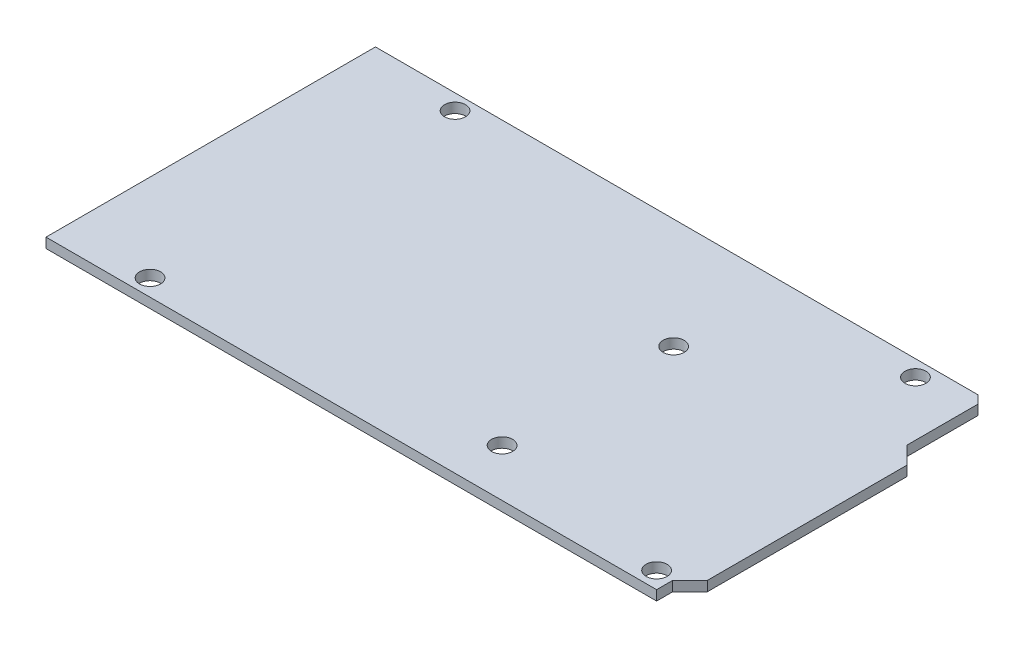
from build123d import *

# Parameters (mm, degrees)
SKETCH1_R           = 1.7
BOSS_EXTRUDE1_DEPTH = 1.6


with BuildPart() as part:
    # Sketch1 → Boss-Extrude1 (new body)
    with BuildSketch(Plane(origin=(0, 0, 0), x_dir=(1, 0, 0), z_dir=(0, 1, 0))):
        Polygon((98.6, 0), (98.6, 2.6), (101.4, 5.4), (101.4, 37.6), (98.6, 40.4), (98.6, 51.9), (97.3, 53.2), (0, 53.2), (0, 0), align=None)
        with Locations(Location((95.9, 2.7, 0), (0, 0, 270))):
            Circle(SKETCH1_R, mode=Mode.SUBTRACT)
        with Locations(Location((89.8, 50.6, 0), (0, 0, 270))):
            Circle(SKETCH1_R, mode=Mode.SUBTRACT)
        with Locations(Location((65.95, 35.4, 0), (0, 0, 270))):
            Circle(SKETCH1_R, mode=Mode.SUBTRACT)
        with Locations(Location((65.95, 7.7, 0), (0, 0, 270))):
            Circle(SKETCH1_R, mode=Mode.SUBTRACT)
        with Locations(Location((15.35, 50.7, 0), (0, 0, 270))):
            Circle(SKETCH1_R, mode=Mode.SUBTRACT)
        with Locations(Location((14.1, 2.7, 0), (0, 0, 270))):
            Circle(SKETCH1_R, mode=Mode.SUBTRACT)
    extrude(amount=BOSS_EXTRUDE1_DEPTH)


solid = part.part
